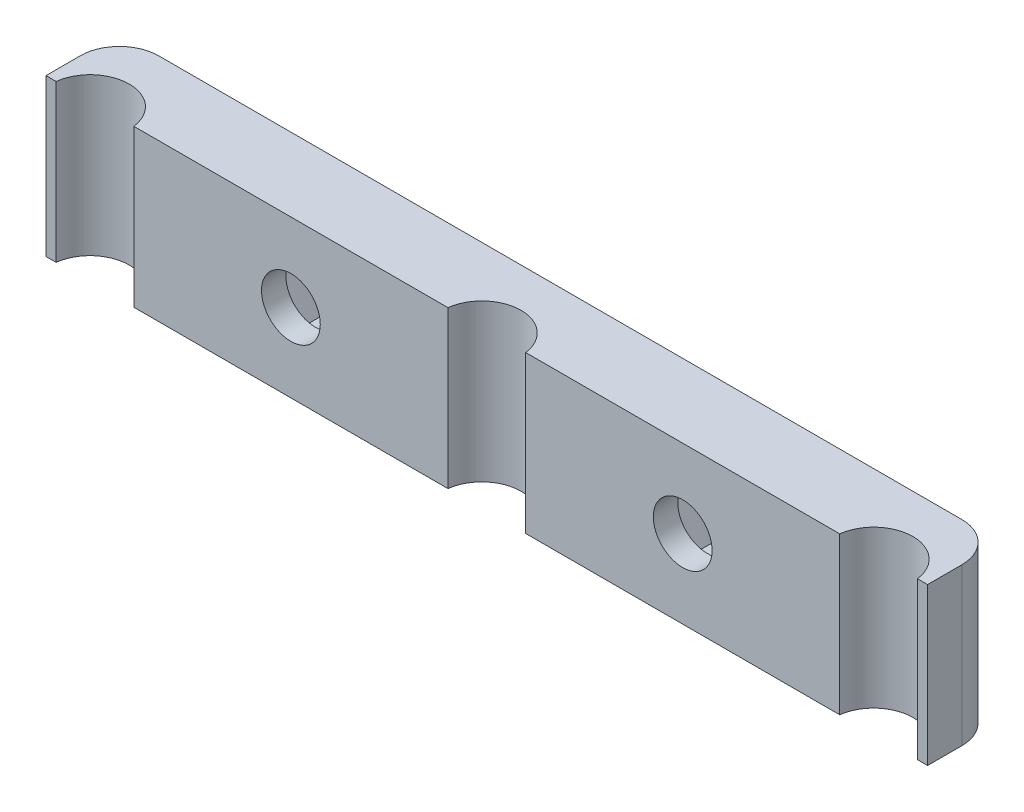
from build123d import *

# Parameters (mm, degrees)
BOSS_EXTRU_1_DEPTH      = 4
CONG_1_R                = 2
ESQUISSE2_R             = 1.5
ENL_V_MAT_EXTRU_1_DEPTH = 24.158421794
ENL_V_MAT_EXTRU_2_DEPTH = 2.5


with BuildPart() as part:
    # Esquisse1 → Boss.-Extru.1 (new, symmetric)
    with BuildSketch(Plane(origin=(0, 0, 0), x_dir=(1, 0, 0), z_dir=(0, 1, 0))):
        with BuildLine():
            Line((22.5, 4), (-22.5, 4))
            Line((-22.5, 4), (-22.5, 0.25))
            Line((-22.5, 0.25), (-21.984313483, 0.25))
            ThreePointArc((-21.984313483, 0.25), (-20, 2), (-18.015686517, 0.25))
            Line((-18.015686517, 0.25), (-1.984313483, 0.25))
            ThreePointArc((-1.984313483, 0.25), (0, 2), (1.984313483, 0.25))
            Line((1.984313483, 0.25), (18.015686517, 0.25))
            ThreePointArc((18.015686517, 0.25), (20, 2), (21.984313483, 0.25))
            Line((21.984313483, 0.25), (22.5, 0.25))
            Line((22.5, 0.25), (22.5, 4))
        make_face()
    extrude(amount=BOSS_EXTRU_1_DEPTH, both=True)

    # Congé1
    cong_1_edges = [part.edges().sort_by_distance(p)[0] for p in [
        (-22.5, 0, -4),
        (22.5, 0, -4),
    ]]
    fillet(cong_1_edges, radius=CONG_1_R)

    # Esquisse2 → Enlèv. mat.-Extru.1 (cut, through all)
    with BuildSketch(Plane.XY.offset(-0.25)):
        with Locations((-10, 0)):
            Circle(ESQUISSE2_R)
        with Locations((10, 0)):
            Circle(ESQUISSE2_R)
    extrude(amount=-ENL_V_MAT_EXTRU_1_DEPTH, mode=Mode.SUBTRACT)

    # Esquisse3 → Enlèv. mat.-Extru.2 (cut)
    with BuildSketch(Plane(origin=(0, 0, -4), x_dir=(-1, 0, 0), z_dir=(0, 0, -1))):
        Polygon((-8.41228676, 2.75), (-11.58771324, 2.75), (-13.175426481, 0), (-11.58771324, -2.75), (-8.41228676, -2.75), (-6.824573519, 0), align=None)
        Polygon((11.58771324, 2.75), (8.41228676, 2.75), (6.824573519, 0), (8.41228676, -2.75), (11.58771324, -2.75), (13.175426481, 0), align=None)
    extrude(amount=-ENL_V_MAT_EXTRU_2_DEPTH, mode=Mode.SUBTRACT)


solid = part.part
